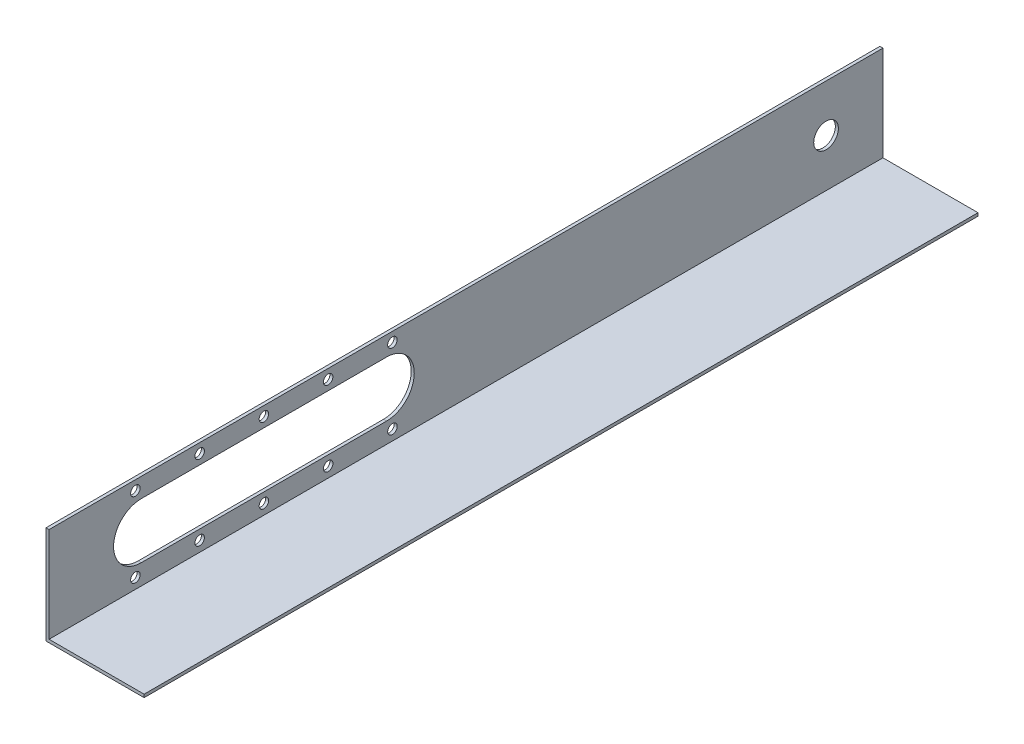
from build123d import *

# Parameters (mm, degrees)
BOSS_EXTRUDE2_DEPTH          = 431.8
CUT_EXTRUDE3_DEPTH           = 127
SKETCH7_R                    = 6.3881
CUT_EXTRUDE4_DEPTH           = 438.372816156
F_10_0_1935_DIAMETER_HOLE3_D = 4.9149


with BuildPart() as part:
    # Sketch3 → Boss-Extrude2 (new body)
    with BuildSketch(Plane.XY):
        Polygon((0, 0), (0, 49.2125), (-1.5875, 49.2125), (-1.5875, -1.5875), (49.2125, -1.5875), (49.2125, 0), align=None)
    extrude(amount=BOSS_EXTRUDE2_DEPTH)

    # Sketch6 → Cut-Extrude3 (cut)
    with BuildSketch(Plane(origin=(0, 0, 0), x_dir=(0, 0, -1), z_dir=(1, 0, 0))):
        with BuildLine():
            Line((-384.048, 39.1795), (-257.048, 39.1795))
            ThreePointArc((-257.048, 39.1795), (-242.697, 24.8285), (-257.048, 10.4775))
            Line((-257.048, 10.4775), (-384.048, 10.4775))
            ThreePointArc((-384.048, 10.4775), (-398.399, 24.8285), (-384.048, 39.1795))
        make_face()
    extrude(amount=-CUT_EXTRUDE3_DEPTH, mode=Mode.SUBTRACT)

    # Sketch7 → Cut-Extrude4 (cut, through all)
    with BuildSketch(Plane(origin=(0, 0, 0), x_dir=(0, 0, -1), z_dir=(1, 0, 0))):
        with Locations(Location((-29.464, 24.773594829, 0), (0, 0, 90))):
            Circle(SKETCH7_R)
    extrude(amount=-CUT_EXTRUDE4_DEPTH, mode=Mode.SUBTRACT)

    # #10 (0.1935) Diameter Hole3 (through all)
    with Locations(Plane(origin=(0, 0, 0), x_dir=(0, 0, -1), z_dir=(1, 0, 0))):
        with Locations((-254, 44.2595), (-287.274, 44.2595), (-320.548, 44.2595), (-254, 5.3975), (-287.274, 5.3975), (-320.548, 5.3975), (-353.822, 44.2595), (-387.096, 44.2595), (-387.096, 5.3975), (-353.822, 5.3975)):
            Hole(F_10_0_1935_DIAMETER_HOLE3_D / 2)


solid = part.part
